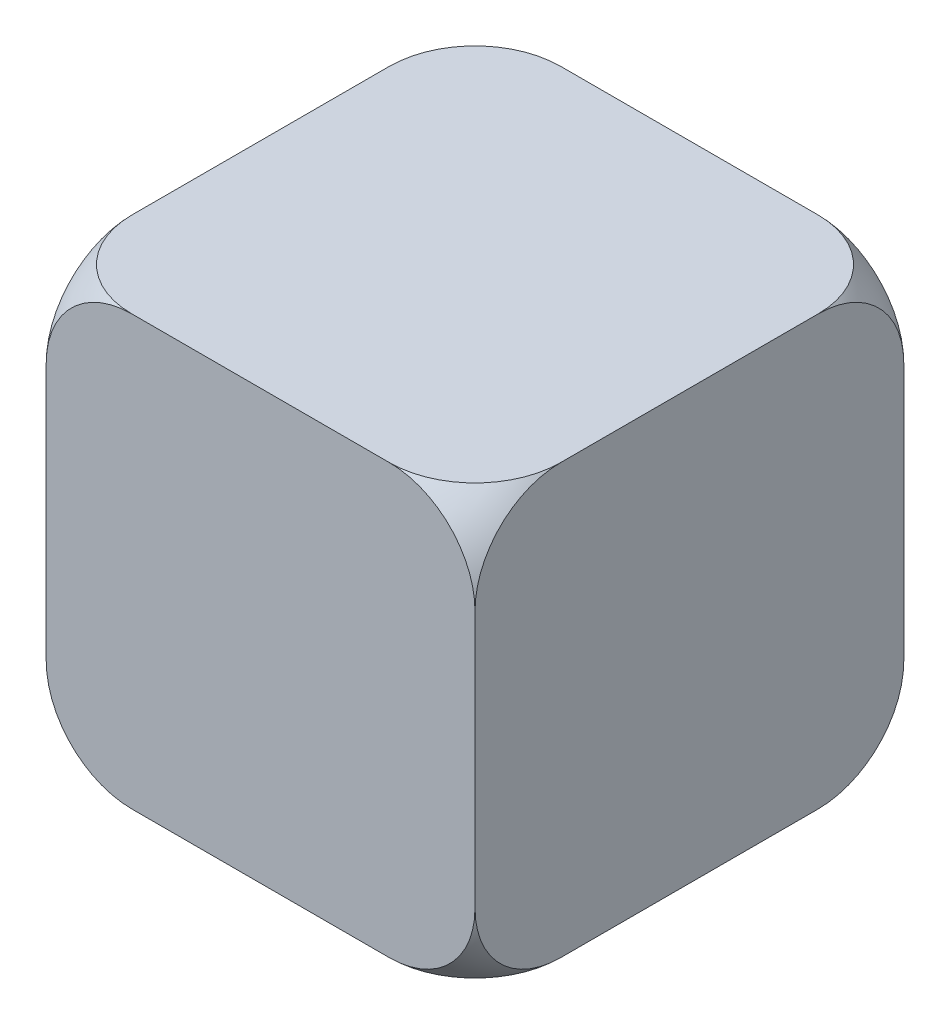
from build123d import *

# Parameters (mm, degrees)
PADR_O_LINEAR2_COUNT       = 2
PADR_O_LINEAR2_PITCH       = 6
PADR_O_LINEAR2_2_COUNT     = 2
PADR_O_LINEAR2_2_PITCH     = 6
CORTE_EXTRUS_O1_DEPTH      = 19.755385946
CORTE_EXTRUS_O1_DEPTH_BACK = 19.755385946
ESBO_O3_W                  = 20
ESBO_O3_H                  = 20
ESBO_O3_W_2                = 2
ESBO_O3_H_2                = 2
CORTE_EXTRUS_O3_DEPTH      = 20
CORTE_EXTRUS_O3_DEPTH_BACK = 10
ESBO_O4_W                  = 20
ESBO_O4_H                  = 20
ESBO_O4_W_2                = 2
ESBO_O4_H_2                = 2
ESBO_O5_W                  = 10
ESBO_O5_H                  = 10
RESSALTO_EXTRUS_O1_DEPTH   = 6
ESBO_O6_W                  = 10
ESBO_O6_H                  = 10
RESSALTO_EXTRUS_O2_DEPTH   = 6
ESBO_O7_W                  = 10
ESBO_O7_H                  = 10
RESSALTO_EXTRUS_O3_DEPTH   = 6


with BuildPart() as part:
    # Esboço2 → Revolução1 (revolve)
    with BuildSketch(Plane.XY.offset(2)):
        with BuildLine():
            Line((2, 2), (-0.828427125, 2))
            ThreePointArc((-0.828427125, 2), (2, -0.828427125), (4.828427125, 2))
            Line((4.828427125, 2), (2, 2))
        make_face()
        with BuildLine():
            Line((8, 2), (5.171572875, 2))
            ThreePointArc((5.171572875, 2), (8, -0.828427125), (10.828427125, 2))
            Line((10.828427125, 2), (8, 2))
        make_face()
    revolve(axis=Axis((2, 2, 2), (-1, 0, 0)))


with BuildPart() as padr_o_linear2_1:
    # Padrão linear2: pattern copy
    add(part.part.moved(Location(Vector(0, 0, 1) * (1 * PADR_O_LINEAR2_PITCH))))


with BuildPart() as padr_o_linear2_2_1:
    # Padr_o linear2 2: pattern copy
    add(part.part.moved(Location(Vector(0, 1, 0) * (1 * PADR_O_LINEAR2_2_PITCH))))


with BuildPart() as padr_o_linear2_2_2:
    # Padr_o linear2 2: pattern copy
    add(padr_o_linear2_1.part.moved(Location(Vector(0, 1, 0) * (1 * PADR_O_LINEAR2_2_PITCH))))


with BuildPart() as corte_extrus_o1_tool:
    # Esboço3 → Corte-extrusão1 (new, two sides: drawn at the far end of the back side and taken through both)
    with BuildSketch(Plane.XY.offset(-CORTE_EXTRUS_O1_DEPTH_BACK)):
        with Locations((5, 5)):
            Rectangle(ESBO_O3_W, ESBO_O3_H)
        with Locations((1, 9)):
            Rectangle(ESBO_O3_W_2, ESBO_O3_H_2, mode=Mode.SUBTRACT)
        with Locations((1, 1)):
            Rectangle(ESBO_O3_W_2, ESBO_O3_H_2, mode=Mode.SUBTRACT)
        with Locations((9, 1)):
            Rectangle(ESBO_O3_W_2, ESBO_O3_H_2, mode=Mode.SUBTRACT)
        with Locations((9, 9)):
            Rectangle(ESBO_O3_W_2, ESBO_O3_H_2, mode=Mode.SUBTRACT)
    extrude(amount=CORTE_EXTRUS_O1_DEPTH + CORTE_EXTRUS_O1_DEPTH_BACK)


with BuildPart() as part_1:
    add(part.part)

    # Corte-extrusão1: cut by corte_extrus_o1_tool
    add(corte_extrus_o1_tool.part, mode=Mode.SUBTRACT)


with BuildPart() as padr_o_linear2_1_1:
    add(padr_o_linear2_1.part)

    # Corte-extrusão1: cut by corte_extrus_o1_tool
    add(corte_extrus_o1_tool.part, mode=Mode.SUBTRACT)


with BuildPart() as padr_o_linear2_2_1_1:
    add(padr_o_linear2_2_1.part)

    # Corte-extrusão1: cut by corte_extrus_o1_tool
    add(corte_extrus_o1_tool.part, mode=Mode.SUBTRACT)


with BuildPart() as padr_o_linear2_2_2_1:
    add(padr_o_linear2_2_2.part)

    # Corte-extrusão1: cut by corte_extrus_o1_tool
    add(corte_extrus_o1_tool.part, mode=Mode.SUBTRACT)


with BuildPart() as corte_extrus_o3_tool:
    # Esboço4 → Corte-extrusão3 (new, two sides: drawn at the far end of the back side and taken through both)
    with BuildSketch(Plane(origin=(0, 0, 0), x_dir=(0, 0, -1), z_dir=(1, 0, 0)).offset(-CORTE_EXTRUS_O3_DEPTH_BACK)):
        with Locations((-5, 5)):
            Rectangle(ESBO_O4_W, ESBO_O4_H)
        with Locations((-9, 9)):
            Rectangle(ESBO_O4_W_2, ESBO_O4_H_2, mode=Mode.SUBTRACT)
        with Locations((-1, 1)):
            Rectangle(ESBO_O4_W_2, ESBO_O4_H_2, mode=Mode.SUBTRACT)
        with Locations((-1, 9)):
            Rectangle(ESBO_O4_W_2, ESBO_O4_H_2, mode=Mode.SUBTRACT)
        with Locations((-9, 1)):
            Rectangle(ESBO_O4_W_2, ESBO_O4_H_2, mode=Mode.SUBTRACT)
    extrude(amount=CORTE_EXTRUS_O3_DEPTH + CORTE_EXTRUS_O3_DEPTH_BACK)


with BuildPart() as part_2:
    add(part_1.part)

    # Corte-extrusão3: cut by corte_extrus_o3_tool
    add(corte_extrus_o3_tool.part, mode=Mode.SUBTRACT)



with BuildPart() as padr_o_linear2_1_2:
    add(padr_o_linear2_1_1.part)

    # Corte-extrusão3: cut by corte_extrus_o3_tool
    add(corte_extrus_o3_tool.part, mode=Mode.SUBTRACT)


with BuildPart() as padr_o_linear2_2_1_2:
    add(padr_o_linear2_2_1_1.part)

    # Corte-extrusão3: cut by corte_extrus_o3_tool
    add(corte_extrus_o3_tool.part, mode=Mode.SUBTRACT)


with BuildPart() as padr_o_linear2_2_2_2:
    add(padr_o_linear2_2_2_1.part)

    # Corte-extrusão3: cut by corte_extrus_o3_tool
    add(corte_extrus_o3_tool.part, mode=Mode.SUBTRACT)


with BuildPart() as part_3:
    add(part_2.part)

    add(padr_o_linear2_1_2.part)  # Ressalto-extrusão1 merges Padrão linear2_1

    add(padr_o_linear2_2_1_2.part)  # Ressalto-extrusão1 merges Padrão linear2 2_1

    add(padr_o_linear2_2_2_2.part)  # Ressalto-extrusão1 merges Padrão linear2 2_2
    # Esboço5 → Ressalto-extrusão1 (add)
    with BuildSketch(Plane.XY.offset(2)):
        with Locations((5, 5)):
            Rectangle(ESBO_O5_W, ESBO_O5_H)
    extrude(amount=RESSALTO_EXTRUS_O1_DEPTH)

    # Esboço6 → Ressalto-extrusão2 (add)
    with BuildSketch(Plane(origin=(2, 0, 0), x_dir=(0, 0, -1), z_dir=(1, 0, 0))):
        with Locations((-5, 5)):
            Rectangle(ESBO_O6_W, ESBO_O6_H)
    extrude(amount=RESSALTO_EXTRUS_O2_DEPTH)

    # Esboço7 → Ressalto-extrusão3 (add)
    with BuildSketch(Plane(origin=(0, 2, 0), x_dir=(1, 0, 0), z_dir=(0, 1, 0))):
        with Locations((5, -5)):
            Rectangle(ESBO_O7_W, ESBO_O7_H)
    extrude(amount=RESSALTO_EXTRUS_O3_DEPTH)


solid = part_3.part
